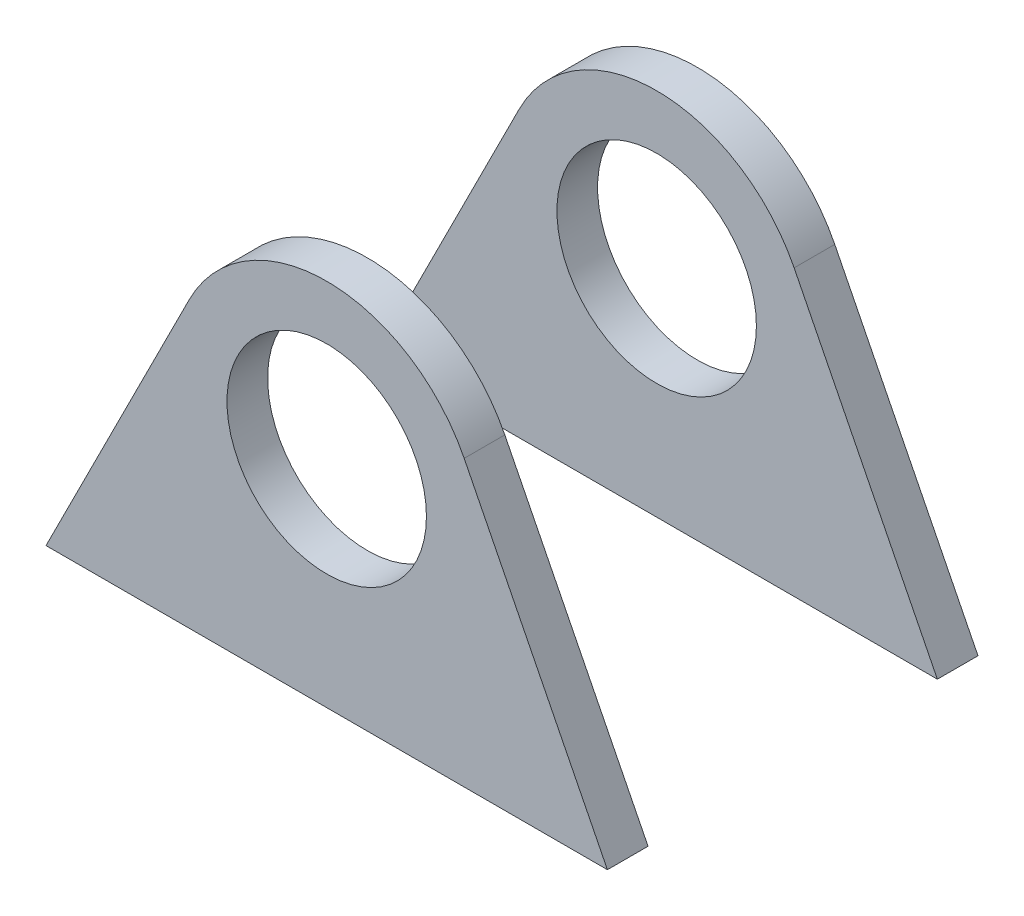
from build123d import *

# Parameters (mm, degrees)
SKETCH1_R           = 8.1
BOSS_EXTRUDE1_DEPTH = 3.3


with BuildPart() as part:
    # Sketch1 → Boss-Extrude1 (new body)
    with BuildSketch(Plane.XY):
        with BuildLine():
            Line((-22.8, -17.5), (22.8, -17.5))
            Line((22.8, -17.5), (11.165886567, 5.618983642))
            ThreePointArc((11.165886567, 5.618983642), (0, 12.5), (-11.165886567, 5.618983642))
            Line((-11.165886567, 5.618983642), (-22.8, -17.5))
        make_face()
        Circle(SKETCH1_R, mode=Mode.SUBTRACT)
    extrude(amount=BOSS_EXTRUDE1_DEPTH)


with BuildPart() as body_2:
    # Mirror6: mirrored copy
    add(part.part.mirror(Plane.XY.offset(15.05)))


solid = Compound([part.part, body_2.part])
